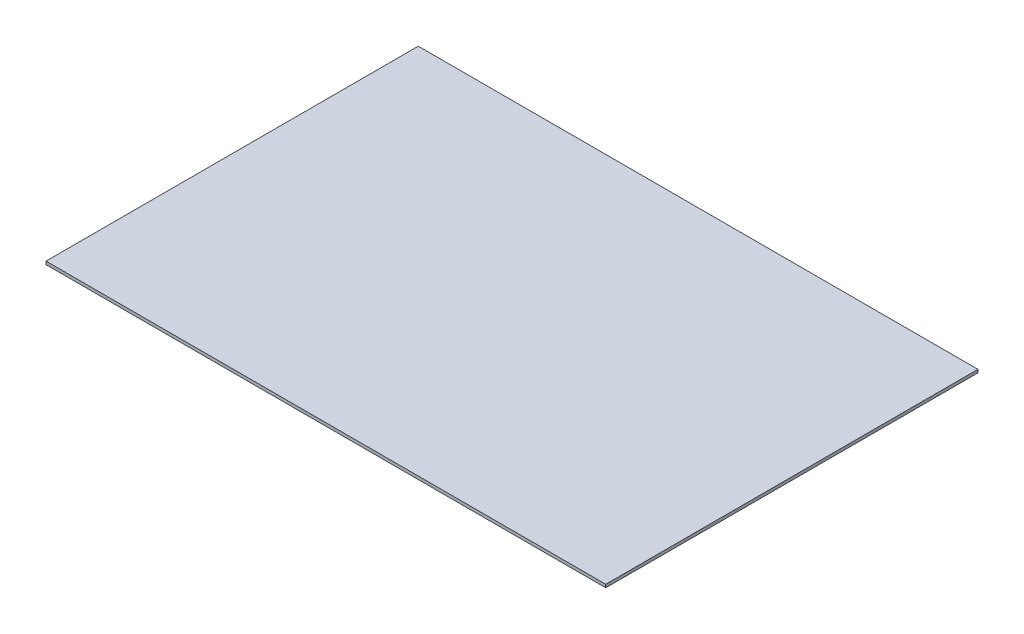
from build123d import *

# Parameters (mm, degrees)
SKETCH1_W           = 274.1
SKETCH1_H           = 182.3
BOSS_EXTRUDE1_DEPTH = 1.5


with BuildPart() as part:
    # Sketch1 → Boss-Extrude1 (new body)
    with BuildSketch(Plane(origin=(0, 0, 0), x_dir=(1, 0, 0), z_dir=(0, 1, 0))):
        with Locations((9.451724138, -17.353846154)):
            Rectangle(SKETCH1_W, SKETCH1_H)
    extrude(amount=BOSS_EXTRUDE1_DEPTH)


solid = part.part
